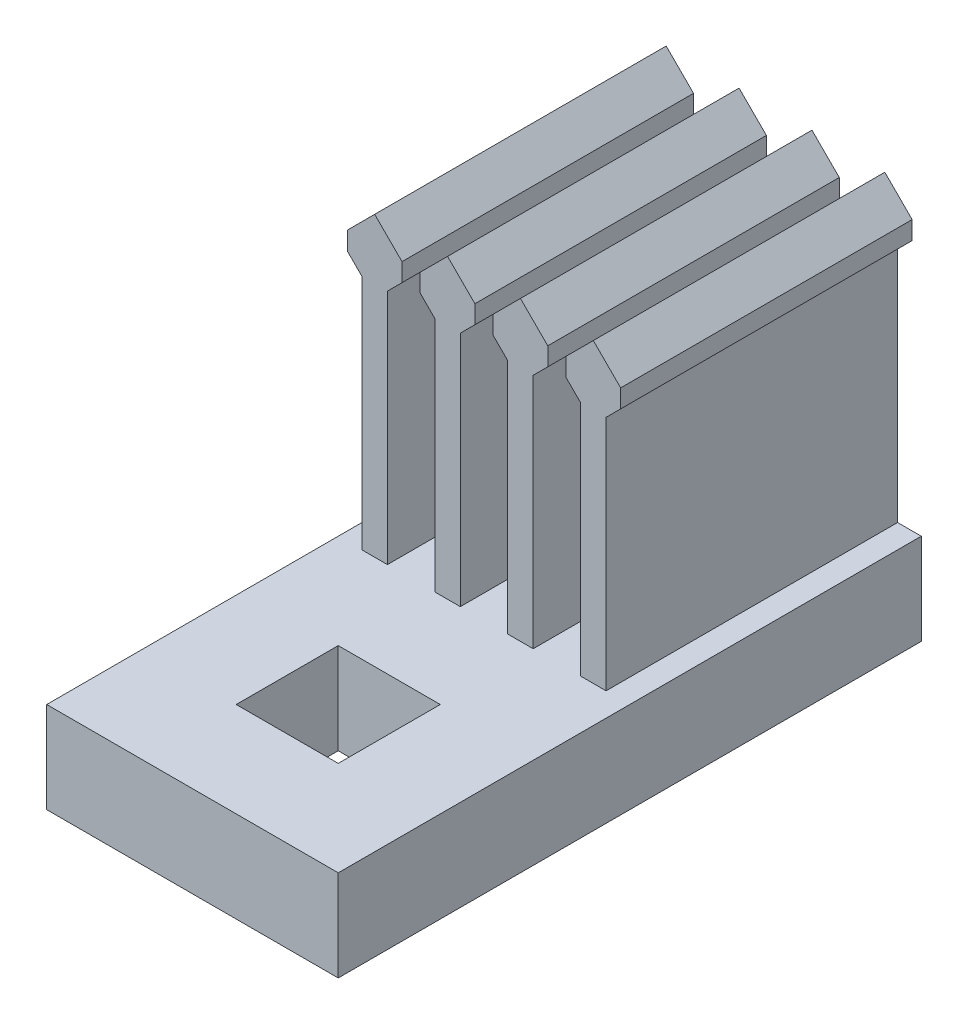
from build123d import *

# Parameters (mm, degrees)
RESSALTO_EXTRUS_O1_DEPTH = 8
ESBO_O4_W                = 8
ESBO_O4_H                = 2.5
RESSALTO_EXTRUS_O3_DEPTH = 8
ESBO_O5_W                = 2.8
ESBO_O5_H                = 2.8
CORTE_EXTRUS_O1_DEPTH    = 20.632180215


with BuildPart() as part:
    # Esboço1 → Ressalto-extrusão1 (new body)
    with BuildSketch(Plane.XY):
        Polygon((0.65, 2.5), (-0.65, 2.5), (-0.65, 9), (-0.25, 9.4), (-0.25, 9.9), (-0.75, 10.4), (-1, 10.65), (-1.25, 10.4), (-1.75, 9.9), (-1.75, 9.4), (-1.35, 9), (-1.35, 2.5), (-2.65, 2.5), (-2.65, 9), (-2.25, 9.4), (-2.25, 9.9), (-2.75, 10.4), (-3, 10.65), (-3.25, 10.4), (-3.75, 9.9), (-3.75, 9.4), (-3.35, 9), (-3.35, 2.5), (-4, 2.5), (-4, 0), (4, 0), (4, 2.5), (3.35, 2.5), (3.35, 9), (3.75, 9.4), (3.75, 9.9), (3.25, 10.4), (3, 10.65), (2.75, 10.4), (2.25, 9.9), (2.25, 9.4), (2.65, 9), (2.65, 2.5), (1.35, 2.5), (1.35, 9), (1.75, 9.4), (1.75, 9.9), (1.25, 10.4), (1, 10.65), (0.75, 10.4), (0.25, 9.9), (0.25, 9.4), (0.65, 9), align=None)
    extrude(amount=RESSALTO_EXTRUS_O1_DEPTH)

    # Esboço4 → Ressalto-extrusão3 (add)
    with BuildSketch(Plane.XY.offset(8)):
        with Locations((0, 1.25)):
            Rectangle(ESBO_O4_W, ESBO_O4_H)
    extrude(amount=RESSALTO_EXTRUS_O3_DEPTH)

    # Esboço5 → Corte-extrusão1 (cut, through all)
    with BuildSketch(Plane.XZ):
        with Locations((0, 12)):
            Rectangle(ESBO_O5_W, ESBO_O5_H)
    extrude(amount=-CORTE_EXTRUS_O1_DEPTH, mode=Mode.SUBTRACT)


solid = part.part
